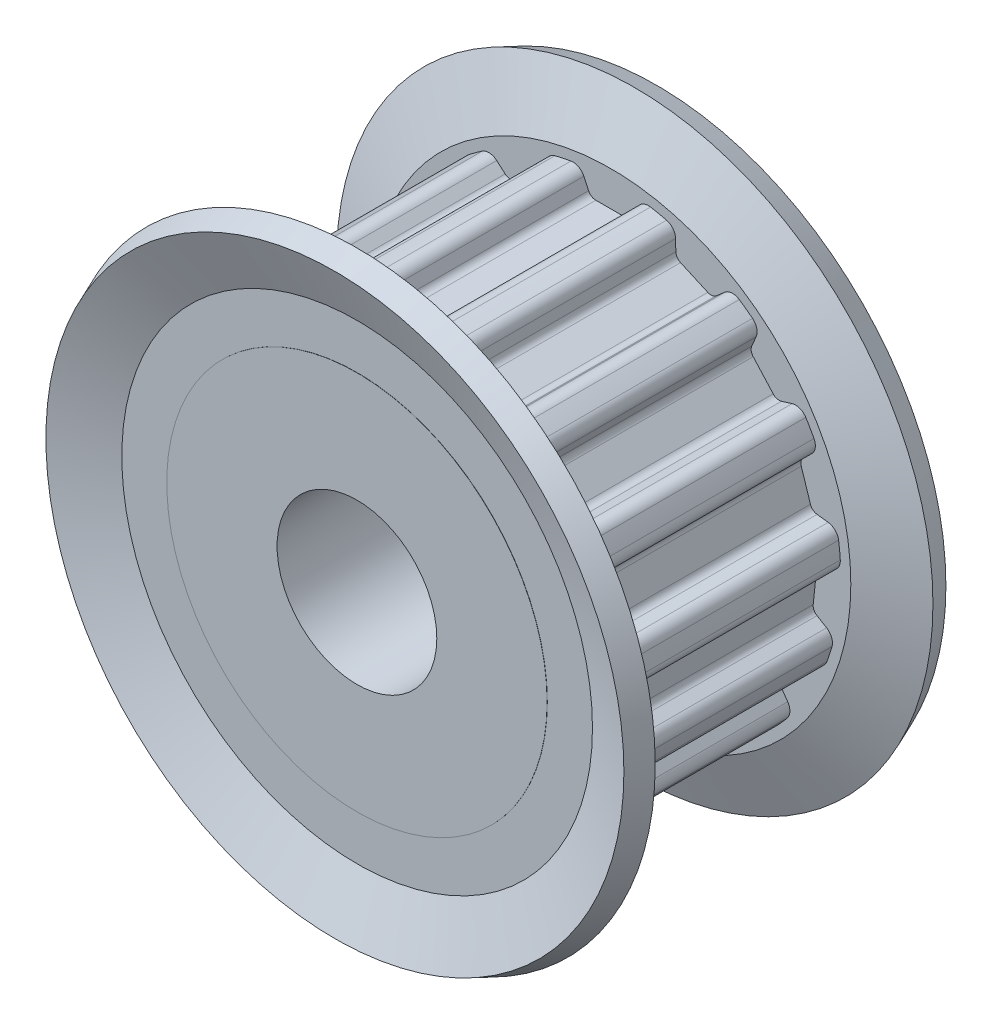
from build123d import *

# Parameters (mm, degrees)
TOOTHEXTRUDECUTGEARBELT01_DEPTH = 5.749999914
PATTERNGEARBELT01_COUNT         = 15
BOREREVOLVESKETCH_W             = 13.91999979
BOREREVOLVESKETCH_H             = 4


with BuildPart() as part:
    # SketchRevolveGearBelt01 → GearBelt01 (revolve)
    with BuildSketch(Plane(origin=(0, 0, 0), x_dir=(0, 0, -1), z_dir=(1, 0, 0))):
        Polygon((6.959999895, 0), (6.959999895, 9.524999857), (6.949999896, 9.524999857), (6.949999896, 11.786304982), (8.063312621, 14.474079664), (6.954657199, 14.933299776), (5.749999914, 12.024999819), (5.749999914, 11.525000827), (-5.749999914, 11.525000827), (-5.749999914, 12.024999819), (-6.954657199, 14.933299776), (-8.063312621, 14.474079664), (-6.949999896, 11.786304982), (-6.949999896, 9.524999857), (-6.959999895, 9.524999857), (-6.959999895, 0), align=None)
    revolve(axis=Axis((0, 0, 0), (0, 0, -1)))

    # SketchToothGearBelt01 → ToothExtrudeCutGearBelt01 (cut, symmetric)
    with BuildSketch(Plane.XY):
        with BuildLine():
            Line((-1.346605253, 11.013778629), (-1.109802523, 10.505953538))
            ThreePointArc((-1.109802523, 10.505953538), (-0.962199254, 10.337644266), (-0.747279414, 10.275000846))
            Line((-0.747279414, 10.275000846), (0.747279414, 10.275000846))
            ThreePointArc((0.747279414, 10.275000846), (0.962199254, 10.337644266), (1.109802523, 10.505953538))
            Line((1.109802523, 10.505953538), (1.346605253, 11.013778629))
            ThreePointArc((1.346605253, 11.013778629), (1.613174654, 11.292327669), (1.994209948, 11.351157242))
            Line((1.994209948, 11.351157242), (0, 13.891157204))
            Line((0, 13.891157204), (-1.994209948, 11.351157242))
            ThreePointArc((-1.994209948, 11.351157242), (-1.613174654, 11.292327669), (-1.346605253, 11.013778629))
        make_face()
    toothextrudecutgearbelt01 = extrude(amount=TOOTHEXTRUDECUTGEARBELT01_DEPTH, both=True, mode=Mode.SUBTRACT)

    # PatternGearBelt01: ToothExtrudeCutGearBelt01 ×15 about axis
    patterngearbelt01_axis = Axis((0, 0, 75.122702417), (0, 0, -1))
    for i in range(1, PATTERNGEARBELT01_COUNT):
        add(toothextrudecutgearbelt01.rotate(patterngearbelt01_axis, i * 360 / PATTERNGEARBELT01_COUNT), mode=Mode.SUBTRACT)

    # BoreRevolveSketch → BoreRevolveCut (revolve, cut)
    with BuildSketch(Plane(origin=(0, 0, 0), x_dir=(0, 0, -1), z_dir=(1, 0, 0))):
        with Locations((0, 2)):
            Rectangle(BOREREVOLVESKETCH_W, BOREREVOLVESKETCH_H)
    revolve(axis=Axis((0, 0, 0), (0, 0, -1)), mode=Mode.SUBTRACT)


solid = part.part
